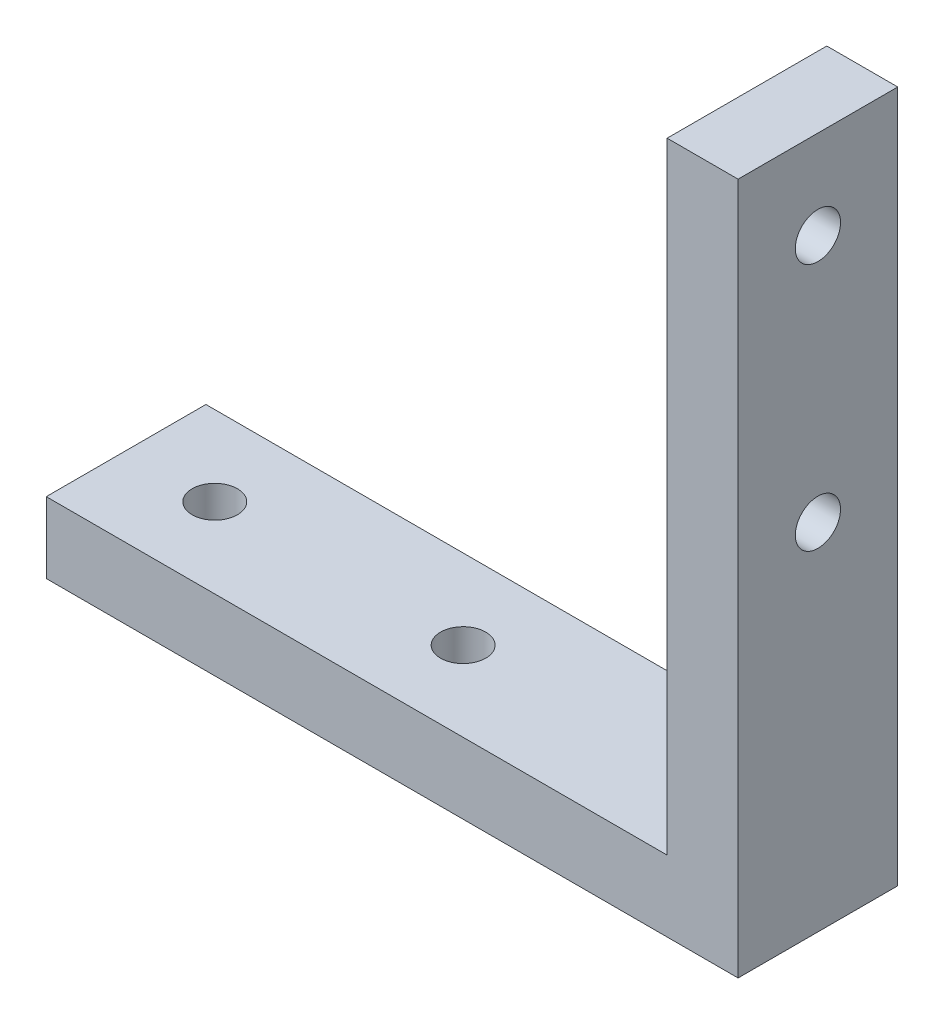
from build123d import *

# Parameters (mm, degrees)
EXTRUDE_1_DEPTH     = 9
SKETCH_2_R          = 2.55
CUT_EXTRUDE_1_DEPTH = 106.190303736
SKETCH_3_R          = 2.55
CUT_EXTRUDE_2_DEPTH = 106.190303736


with BuildPart() as part:
    # 草图1 → 凸台-拉伸1 (new, symmetric)
    with BuildSketch(Plane.XY):
        Polygon((0, 78), (0, 0), (-78, 0), (-78, 8), (-8, 8), (-8, 78), align=None)
    extrude(amount=EXTRUDE_1_DEPTH, both=True)

    # 草图2 → 切除-拉伸1 (cut, through all)
    with BuildSketch(Plane(origin=(0, 8, 0), x_dir=(1, 0, 0), z_dir=(0, 1, 0))):
        with Locations(Location((-68, 0, 0), (0, 0, 180))):
            Circle(SKETCH_2_R)
        with Locations(Location((-40, 0, 0), (0, 0, 180))):
            Circle(SKETCH_2_R)
    extrude(amount=-CUT_EXTRUDE_1_DEPTH, mode=Mode.SUBTRACT)

    # 草图3 → 切除-拉伸2 (cut, through all)
    with BuildSketch(Plane.ZY.offset(8)):
        with Locations(Location((0, 40, 0), (0, 0, 270))):
            Circle(SKETCH_3_R)
        with Locations(Location((0, 68, 0), (0, 0, 270))):
            Circle(SKETCH_3_R)
    extrude(amount=-CUT_EXTRUDE_2_DEPTH, mode=Mode.SUBTRACT)


solid = part.part
